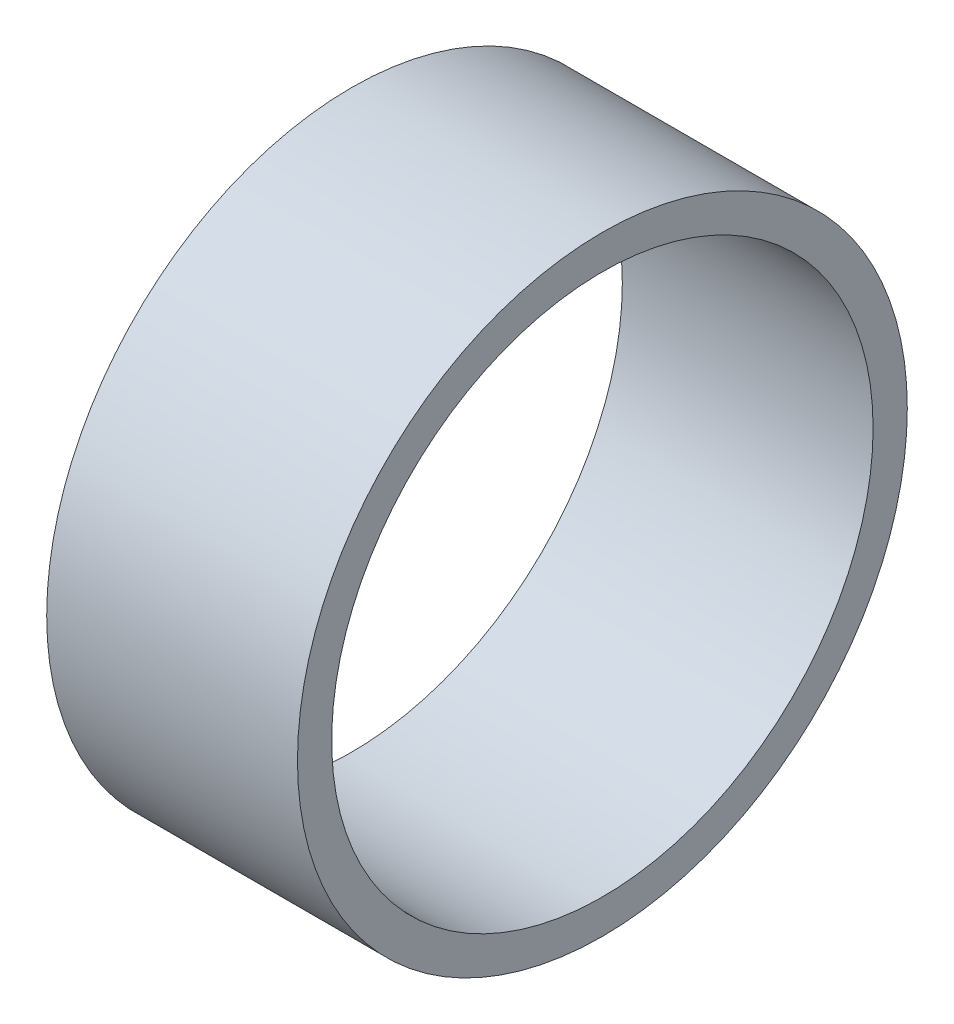
from build123d import *

# Parameters (mm, degrees)
SKETCH_2_R      = 53.5
SKETCH_2_R_2    = 47.5
EXTRUDE_1_DEPTH = 44


with BuildPart() as part:
    # 草图2 → 凸台-拉伸1 (new body)
    with BuildSketch(Plane(origin=(0, 0, 0), x_dir=(0, 0, -1), z_dir=(1, 0, 0))):
        Circle(SKETCH_2_R)
        Circle(SKETCH_2_R_2, mode=Mode.SUBTRACT)
    extrude(amount=EXTRUDE_1_DEPTH)


solid = part.part
